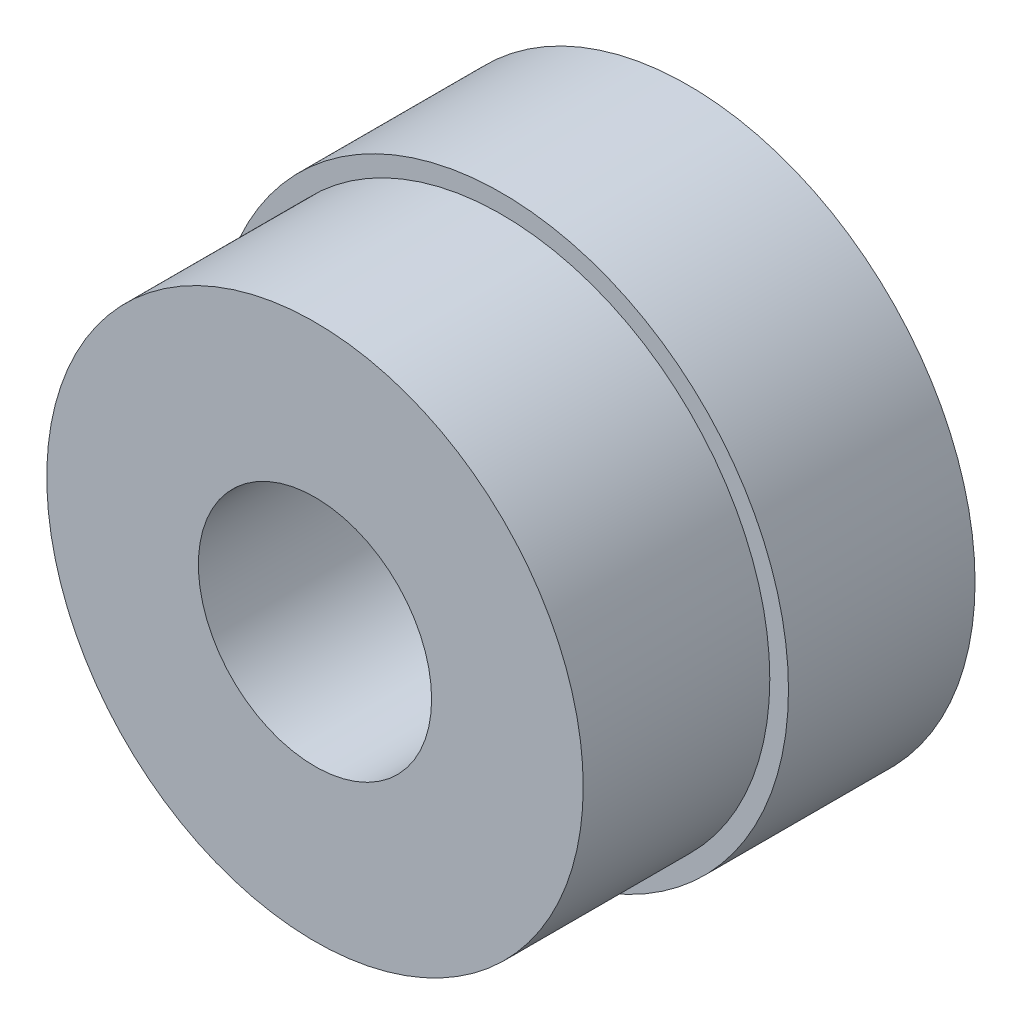
from build123d import *

# Parameters (mm, degrees)
SKETCH1_R           = 6.15
BOSS_EXTRUDE1_DEPTH = 4
SKETCH4_R           = 5.75
BOSS_EXTRUDE3_DEPTH = 4
SKETCH5_R           = 2.5
CUT_EXTRUDE1_DEPTH  = 12.817148556


with BuildPart() as part:
    # Sketch1 → Boss-Extrude1 (new body)
    with BuildSketch(Plane.XY):
        Circle(SKETCH1_R)
    extrude(amount=BOSS_EXTRUDE1_DEPTH)

    # Sketch4 → Boss-Extrude3 (add)
    with BuildSketch(Plane.XY.offset(4)):
        Circle(SKETCH4_R)
    extrude(amount=BOSS_EXTRUDE3_DEPTH)

    # Sketch5 → Cut-Extrude1 (cut, through all)
    with BuildSketch(Plane.XY.offset(8)):
        Circle(SKETCH5_R)
    extrude(amount=-CUT_EXTRUDE1_DEPTH, mode=Mode.SUBTRACT)


solid = part.part
